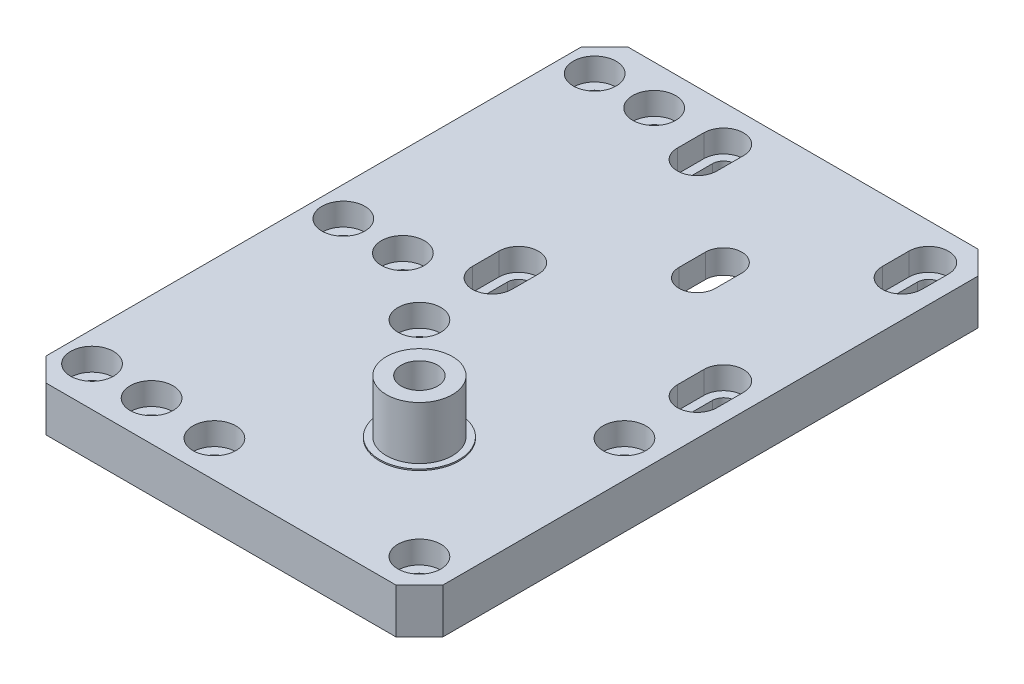
from build123d import *

# Parameters (mm, degrees)
SKETCH_1_W                   = 60
SKETCH_1_H                   = 88
EXTRUDE_1_DEPTH              = 6.8
SKETCH_2_R                   = 2.75
CUT_EXTRUDE_6_DEPTH          = 63.659715927
SKETCH_3_R                   = 11.05
CUT_EXTRUDE_7_DEPTH          = 3.2
SKETCH_4_R                   = 4.99
SKETCH_4_R_2                 = 2.75
EXTRUDE_2_DEPTH              = 8.2
SKETCH_5_R                   = 6
SKETCH_5_R_2                 = 4
EXTRUDE_1349_DEPTH           = 0.2
HOLE_WIZARD_M3_2_AT_2_COUNT  = 2
HOLE_WIZARD_M3_2_AT_2_PITCH  = 31
HOLE_WIZARD_M3_2_AT_3_COUNT  = 2
HOLE_WIZARD_M3_2_AT_3_PITCH  = 46.585942086
HOLE_WIZARD_M3_2_AT_4_COUNT  = 2
HOLE_WIZARD_M3_2_AT_4_PITCH  = 43.840620434
HOLE_WIZARD_M3_2_AT_5_COUNT  = 2
HOLE_WIZARD_M3_2_AT_5_PITCH  = 31
HOLE_WIZARD_M3_2_AT_6_COUNT  = 2
HOLE_WIZARD_M3_2_AT_6_PITCH  = 49.307707308
HOLE_WIZARD_M3_2_AT_7_COUNT  = 2
HOLE_WIZARD_M3_2_AT_7_PITCH  = 20.426698216
HOLE_WIZARD_M3_2_AT_8_COUNT  = 2
HOLE_WIZARD_M3_2_AT_8_PITCH  = 35.933967218
HOLE_WIZARD_M3_2_AT_9_COUNT  = 2
HOLE_WIZARD_M3_2_AT_9_PITCH  = 12.5
HOLE_WIZARD_M3_2_AT_10_COUNT = 2
HOLE_WIZARD_M3_2_AT_10_PITCH = 32.097507691
CUT_EXTRUDE_8_DEPTH          = 63.827064232
CUT_EXTRUDE_9_DEPTH          = 3.4
CHAMFER_1_SIZE               = 3.535533906


with BuildPart() as part:
    # 草图1 → 凸台-拉伸1 (new body)
    with BuildSketch(Plane(origin=(0, 0, 0), x_dir=(1, 0, 0), z_dir=(0, 1, 0))):
        with Locations((12, 2)):
            Rectangle(SKETCH_1_W, SKETCH_1_H)
    extrude(amount=EXTRUDE_1_DEPTH)

    # 草图2 → 切除-拉伸6 (cut, through all)
    with BuildSketch(Plane(origin=(0, 0, 0), x_dir=(1, 0, 0), z_dir=(0, 1, 0))):
        with Locations(Location((21, -21, 0), (0, 0, 270))):
            Circle(SKETCH_2_R)
        with BuildLine():
            Line((18.25, 21), (18.25, 25))
            ThreePointArc((18.25, 25), (21, 27.75), (23.75, 25))
            Line((23.75, 25), (23.75, 21))
            ThreePointArc((23.75, 21), (21, 18.25), (18.25, 21))
        make_face()
    extrude(amount=CUT_EXTRUDE_6_DEPTH, mode=Mode.SUBTRACT)

    # 草图3 → 切除-拉伸7 (cut)
    with BuildSketch(Plane.XZ):
        with Locations(Location((21, 21, 0), (0, 0, 270))):
            Circle(SKETCH_3_R)
        with BuildLine():
            Line((32.05, -21), (32.05, -25))
            ThreePointArc((32.05, -25), (21, -36.05), (9.95, -25))
            Line((9.95, -25), (9.95, -21))
            ThreePointArc((9.95, -21), (21, -9.95), (32.05, -21))
        make_face()
    extrude(amount=-CUT_EXTRUDE_7_DEPTH, mode=Mode.SUBTRACT)

    # 草图4 → 凸台-拉伸2 (add)
    with BuildSketch(Plane(origin=(0, 6.8, 0), x_dir=(1, 0, 0), z_dir=(0, 1, 0))):
        with Locations(Location((21, -21, 0), (0, 0, 270))):
            Circle(SKETCH_4_R)
        with Locations(Location((21, -21, 0), (0, 0, 90))):
            Circle(SKETCH_4_R_2, mode=Mode.SUBTRACT)
    extrude(amount=EXTRUDE_2_DEPTH)

    # 草图5 → Extrude 1349 (add)
    with BuildSketch(Plane(origin=(0, 6.8, 0), x_dir=(1, 0, 0), z_dir=(0, 1, 0))):
        with Locations(Location((21, -21, 0), (0, 0, 270))):
            Circle(SKETCH_5_R)
        with Locations((21, -21)):
            Circle(SKETCH_5_R_2, mode=Mode.SUBTRACT)
    extrude(amount=EXTRUDE_1349_DEPTH)

    # 草图8 → M3 六角凹头螺钉的柱形沉头孔2 (revolve, cut)
    with BuildSketch(Plane(origin=(5.5, 6.8, 5.5), x_dir=(0, 0, 1), z_dir=(1, 0, 0))):
        Polygon((0, 0), (0, 26.021463052), (1.7, 25), (1.7, 3.415021515), (1.725, 3.4), (3.25, 3.4), (3.25, 0), align=None)
    hole_wizard_m3_2 = revolve(axis=Axis((5.5, 13.15, 5.5), (0, -1, 0)), mode=Mode.SUBTRACT)

    # M3 六角凹头螺钉的柱形沉头孔2 at 2: M3 六角凹头螺钉的柱形沉头孔2 ×2
    with Locations(*[(i * HOLE_WIZARD_M3_2_AT_2_PITCH, 0, 0) for i in range(1, HOLE_WIZARD_M3_2_AT_2_COUNT)]):
        add(hole_wizard_m3_2, mode=Mode.SUBTRACT)

    # M3 六角凹头螺钉的柱形沉头孔2 at 3: M3 六角凹头螺钉的柱形沉头孔2 ×2
    with Locations(*[Vector(-0.21465703069033118, 0, -0.9766894896410068) * (i * HOLE_WIZARD_M3_2_AT_3_PITCH) for i in range(1, HOLE_WIZARD_M3_2_AT_3_COUNT)]):
        add(hole_wizard_m3_2, mode=Mode.SUBTRACT)

    # M3 六角凹头螺钉的柱形沉头孔2 at 4: M3 六角凹头螺钉的柱形沉头孔2 ×2
    with Locations(*[Vector(0.7071067811865475, 0, 0.7071067811865476) * (i * HOLE_WIZARD_M3_2_AT_4_PITCH) for i in range(1, HOLE_WIZARD_M3_2_AT_4_COUNT)]):
        add(hole_wizard_m3_2, mode=Mode.SUBTRACT)

    # M3 六角凹头螺钉的柱形沉头孔2 at 5: M3 六角凹头螺钉的柱形沉头孔2 ×2
    with Locations(*[(0, 0, i * HOLE_WIZARD_M3_2_AT_5_PITCH) for i in range(1, HOLE_WIZARD_M3_2_AT_5_COUNT)]):
        add(hole_wizard_m3_2, mode=Mode.SUBTRACT)

    # M3 六角凹头螺钉的柱形沉头孔2 at 6: M3 六角凹头螺钉的柱形沉头孔2 ×2
    with Locations(*[Vector(-0.38533529618817947, 0, -0.9227766303453767) * (i * HOLE_WIZARD_M3_2_AT_6_PITCH) for i in range(1, HOLE_WIZARD_M3_2_AT_6_COUNT)]):
        add(hole_wizard_m3_2, mode=Mode.SUBTRACT)

    # M3 六角凹头螺钉的柱形沉头孔2 at 7: M3 六角凹头螺钉的柱形沉头孔2 ×2
    with Locations(*[Vector(-0.9301552213313194, 0, -0.36716653473605715) * (i * HOLE_WIZARD_M3_2_AT_7_PITCH) for i in range(1, HOLE_WIZARD_M3_2_AT_7_COUNT)]):
        add(hole_wizard_m3_2, mode=Mode.SUBTRACT)

    # M3 六角凹头螺钉的柱形沉头孔2 at 8: M3 六角凹头螺钉的柱形沉头孔2 ×2
    with Locations(*[Vector(-0.5287476299210512, 0, 0.8487790901364567) * (i * HOLE_WIZARD_M3_2_AT_8_PITCH) for i in range(1, HOLE_WIZARD_M3_2_AT_8_COUNT)]):
        add(hole_wizard_m3_2, mode=Mode.SUBTRACT)

    # M3 六角凹头螺钉的柱形沉头孔2 at 9: M3 六角凹头螺钉的柱形沉头孔2 ×2
    with Locations(*[Vector(-0.7999999999999885, 0, -0.6000000000000153) * (i * HOLE_WIZARD_M3_2_AT_9_PITCH) for i in range(1, HOLE_WIZARD_M3_2_AT_9_COUNT)]):
        add(hole_wizard_m3_2, mode=Mode.SUBTRACT)

    # M3 六角凹头螺钉的柱形沉头孔2 at 10: M3 六角凹头螺钉的柱形沉头孔2 ×2
    with Locations(*[Vector(-0.3115506691716164, 0, 0.9502295409735051) * (i * HOLE_WIZARD_M3_2_AT_10_PITCH) for i in range(1, HOLE_WIZARD_M3_2_AT_10_COUNT)]):
        add(hole_wizard_m3_2, mode=Mode.SUBTRACT)

    # 草图9 → 切除-拉伸8 (cut, through all)
    with BuildSketch(Plane(origin=(0, 6.8, 0), x_dir=(1, 0, 0), z_dir=(0, 1, 0))):
        with BuildLine():
            Line((3.8, 5.5), (3.8, 9.5))
            ThreePointArc((3.8, 9.5), (5.5, 11.2), (7.2, 9.5))
            Line((7.2, 9.5), (7.2, 5.5))
            ThreePointArc((7.2, 5.5), (5.5, 3.8), (3.8, 5.5))
        make_face()
        with BuildLine():
            Line((34.8, 5.5), (34.8, 9.5))
            ThreePointArc((34.8, 9.5), (36.5, 11.2), (38.2, 9.5))
            Line((38.2, 9.5), (38.2, 5.5))
            ThreePointArc((38.2, 5.5), (36.5, 3.8), (34.8, 5.5))
        make_face()
        with BuildLine():
            Line((34.8, 36.5), (34.8, 40.5))
            ThreePointArc((34.8, 40.5), (36.5, 42.2), (38.2, 40.5))
            Line((38.2, 40.5), (38.2, 36.5))
            ThreePointArc((38.2, 36.5), (36.5, 34.8), (34.8, 36.5))
        make_face()
        with BuildLine():
            Line((3.8, 36.5), (3.8, 40.5))
            ThreePointArc((3.8, 40.5), (5.5, 42.2), (7.2, 40.5))
            Line((7.2, 40.5), (7.2, 36.5))
            ThreePointArc((7.2, 36.5), (5.5, 34.8), (3.8, 36.5))
        make_face()
    extrude(amount=-CUT_EXTRUDE_8_DEPTH, mode=Mode.SUBTRACT)

    # 草图10 → 切除-拉伸9 (cut)
    # profile 1 of 4: a face of its own
    with BuildSketch(Plane(origin=(0, 6.8, 0), x_dir=(1, 0, 0), z_dir=(0, 1, 0))):
        with BuildLine():
            Line((2.5, 5.5), (2.5, 9.5))
            ThreePointArc((2.5, 9.5), (5.5, 12.5), (8.5, 9.5))
            Line((8.5, 9.5), (8.5, 5.5))
            ThreePointArc((8.5, 5.5), (5.5, 2.5), (2.5, 5.5))
        make_face()
        with BuildLine():
            Line((7.2, 5.5), (7.2, 9.5))
            ThreePointArc((7.2, 9.5), (5.5, 11.2), (3.8, 9.5))
            Line((3.8, 9.5), (3.8, 5.5))
            ThreePointArc((3.8, 5.5), (5.5, 3.8), (7.2, 5.5))
        make_face(mode=Mode.SUBTRACT)
    # profile 2 of 4: a face of its own
    with BuildSketch(Plane(origin=(0, 6.8, 0), x_dir=(1, 0, 0), z_dir=(0, 1, 0))):
        with BuildLine():
            Line((33.5, 5.5), (33.5, 9.5))
            ThreePointArc((33.5, 9.5), (36.5, 12.5), (39.5, 9.5))
            Line((39.5, 9.5), (39.5, 5.5))
            ThreePointArc((39.5, 5.5), (36.5, 2.5), (33.5, 5.5))
        make_face()
        with BuildLine():
            Line((34.8, 9.5), (34.8, 5.5))
            ThreePointArc((34.8, 5.5), (36.5, 3.8), (38.2, 5.5))
            Line((38.2, 5.5), (38.2, 9.5))
            ThreePointArc((38.2, 9.5), (36.5, 11.2), (34.8, 9.5))
        make_face(mode=Mode.SUBTRACT)
    # profile 3 of 4: a face of its own
    with BuildSketch(Plane(origin=(0, 6.8, 0), x_dir=(1, 0, 0), z_dir=(0, 1, 0))):
        with BuildLine():
            Line((33.5, 36.5), (33.5, 40.5))
            ThreePointArc((33.5, 40.5), (36.5, 43.5), (39.5, 40.5))
            Line((39.5, 40.5), (39.5, 36.5))
            ThreePointArc((39.5, 36.5), (36.5, 33.5), (33.5, 36.5))
        make_face()
        with BuildLine():
            Line((38.2, 36.5), (38.2, 40.5))
            ThreePointArc((38.2, 40.5), (36.5, 42.2), (34.8, 40.5))
            Line((34.8, 40.5), (34.8, 36.5))
            ThreePointArc((34.8, 36.5), (36.5, 34.8), (38.2, 36.5))
        make_face(mode=Mode.SUBTRACT)
    # profile 4 of 4: a face of its own
    with BuildSketch(Plane(origin=(0, 6.8, 0), x_dir=(1, 0, 0), z_dir=(0, 1, 0))):
        with BuildLine():
            Line((2.5, 36.5), (2.5, 40.5))
            ThreePointArc((2.5, 40.5), (5.5, 43.5), (8.5, 40.5))
            Line((8.5, 40.5), (8.5, 36.5))
            ThreePointArc((8.5, 36.5), (5.5, 33.5), (2.5, 36.5))
        make_face()
        with BuildLine():
            Line((3.8, 40.5), (3.8, 36.5))
            ThreePointArc((3.8, 36.5), (5.5, 34.8), (7.2, 36.5))
            Line((7.2, 36.5), (7.2, 40.5))
            ThreePointArc((7.2, 40.5), (5.5, 42.2), (3.8, 40.5))
        make_face(mode=Mode.SUBTRACT)
    extrude(amount=-CUT_EXTRUDE_9_DEPTH, mode=Mode.SUBTRACT)

    # 倒角1
    chamfer_1_edges = [part.edges().sort_by_distance(p)[0] for p in [
        (-18, 3.4, -46),
        (42, 3.4, -46),
        (42, 3.4, 42),
        (-18, 3.4, 42),
    ]]
    chamfer(chamfer_1_edges, length=CHAMFER_1_SIZE)


solid = part.part
